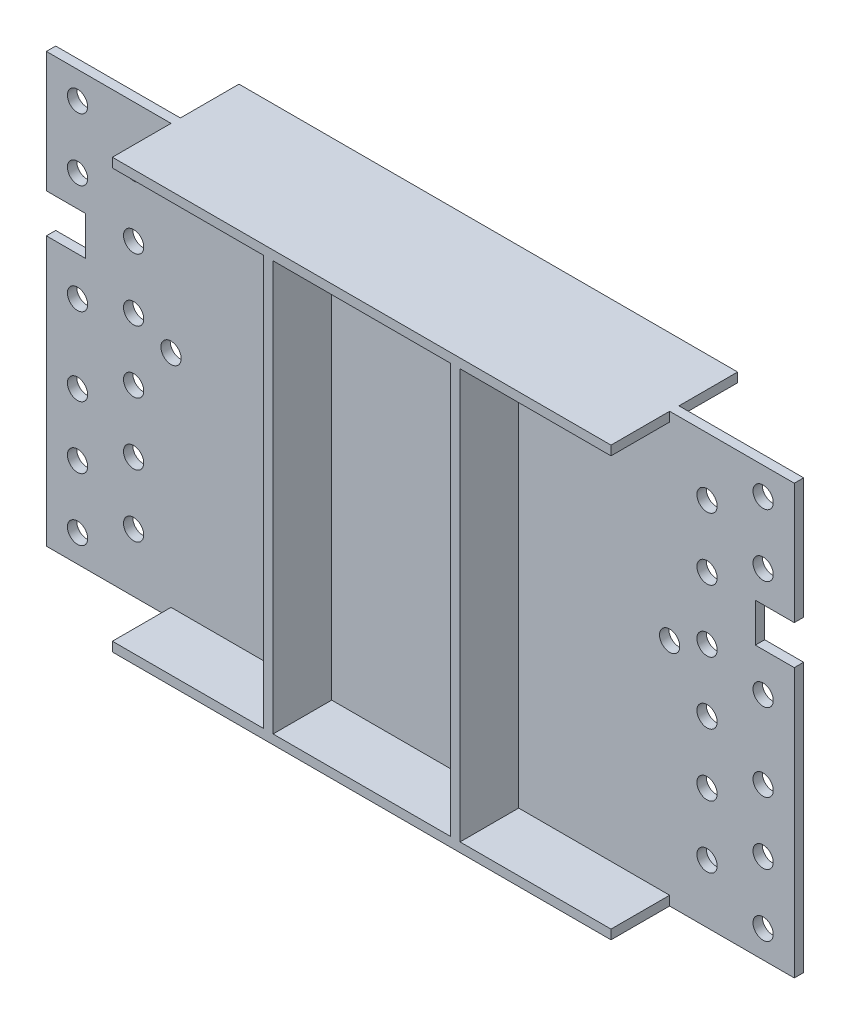
from build123d import *

# Parameters (mm, degrees)
SKETCH_1_W          = 960
SKETCH_1_H          = 550
EXTRUDE_1_DEPTH     = 12
SKETCH_2_W          = 640
SKETCH_2_H          = 162.5
EXTRUDE_2_DEPTH     = 12
SKETCH_3_W          = 640
SKETCH_3_H          = 162.5
EXTRUDE_3_DEPTH     = 12
SKETCH_4_W          = 12.5
SKETCH_4_H          = 526
EXTRUDE_4_DEPTH     = 162.5
SKETCH_5_R          = 13
CUT_EXTRUDE_1_DEPTH = 1110.825464882
SKETCH_6_W          = 50
SKETCH_6_H          = 50
CUT_EXTRUDE_2_DEPTH = 1110.825464882


with BuildPart() as part:
    # 草图1 → 凸台-拉伸1 (new body)
    with BuildSketch(Plane.XY):
        with Locations((480, 275)):
            Rectangle(SKETCH_1_W, SKETCH_1_H)
    extrude(amount=EXTRUDE_1_DEPTH)

    # 草图2 → 凸台-拉伸2 (add)
    with BuildSketch(Plane(origin=(0, 550, 0), x_dir=(1, 0, 0), z_dir=(0, 1, 0))):
        with Locations((480, -6)):
            Rectangle(SKETCH_2_W, SKETCH_2_H)
    extrude(amount=-EXTRUDE_2_DEPTH)

    # 草图3 → 凸台-拉伸3 (add)
    with BuildSketch(Plane.XZ):
        with Locations((480, 6)):
            Rectangle(SKETCH_3_W, SKETCH_3_H)
    extrude(amount=-EXTRUDE_3_DEPTH)

    # 草图4 → 凸台-拉伸4 (add)
    with BuildSketch(Plane(origin=(0, 0, -75.25), x_dir=(-1, 0, 0), z_dir=(0, 0, -1))):
        with Locations((-600, 275)):
            Rectangle(SKETCH_4_W, SKETCH_4_H)
        with Locations((-360, 275)):
            Rectangle(SKETCH_4_W, SKETCH_4_H)
    extrude(amount=-EXTRUDE_4_DEPTH)

    # 草图5 → 切除-拉伸1 (cut, through all)
    with BuildSketch(Plane.XY.offset(12)):
        with Locations((40, 515)):
            Circle(SKETCH_5_R)
        with Locations((40, 435)):
            Circle(SKETCH_5_R)
        with Locations((40, 295)):
            Circle(SKETCH_5_R)
        with Locations((40, 35)):
            Circle(SKETCH_5_R)
        with Locations((112, 235)):
            Circle(SKETCH_5_R)
        with Locations((112, 155)):
            Circle(SKETCH_5_R)
        with Locations((112, 475)):
            Circle(SKETCH_5_R)
        with Locations((112, 395)):
            Circle(SKETCH_5_R)
        with Locations((112, 315)):
            Circle(SKETCH_5_R)
        with Locations((112, 75)):
            Circle(SKETCH_5_R)
        with Locations((40, 195)):
            Circle(SKETCH_5_R)
        with Locations((40, 115)):
            Circle(SKETCH_5_R)
        with Locations((160, 295)):
            Circle(SKETCH_5_R)
    cut_extrude_1 = extrude(amount=-CUT_EXTRUDE_1_DEPTH, mode=Mode.SUBTRACT)

    # 镜向1: 切除-拉伸1 across plane
    add(cut_extrude_1.mirror(Plane.ZY.offset(-480)), mode=Mode.SUBTRACT)

    # 草图6 → 切除-拉伸2 (cut, through all)
    with BuildSketch(Plane(origin=(0, 0, 0), x_dir=(-1, 0, 0), z_dir=(0, 0, -1))):
        with Locations((-25, 370)):
            Rectangle(SKETCH_6_W, SKETCH_6_H)
        with Locations((-935, 370)):
            Rectangle(SKETCH_6_W, SKETCH_6_H)
    extrude(amount=-CUT_EXTRUDE_2_DEPTH, mode=Mode.SUBTRACT)


solid = part.part
